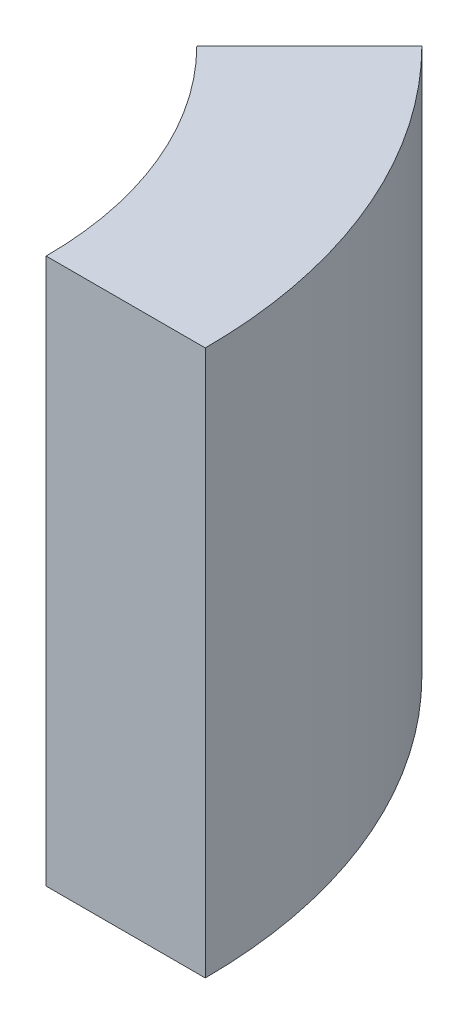
from build123d import *

# Parameters (mm, degrees)
BOSS_EXTRUDE1_DEPTH = 24
BOSS_EXTRUDE2_START = 1.5
BOSS_EXTRUDE2_DEPTH = 1.5


with BuildPart() as part:
    # Sketch1 → Boss-Extrude1 (new body)
    with BuildSketch(Plane(origin=(0, 0, 0), x_dir=(1, 0, 0), z_dir=(0, 1, 0))):
        with BuildLine():
            Line((11.313708499, 11.313708499), (16.263455967, 16.263455967))
            ThreePointArc((16.263455967, 16.263455967), (21.249229248, 8.801718944), (23, 0))
            Line((23, 0), (16, 0))
            ThreePointArc((16, 0), (14.78207252, 6.122934918), (11.313708499, 11.313708499))
        make_face()
    extrude(amount=BOSS_EXTRUDE1_DEPTH)

    # Sketch4 → Boss-Extrude2 (add)
    with BuildSketch(Plane.XZ.offset(BOSS_EXTRUDE2_START)):
        with BuildLine():
            Line((14.44136455, -6.888177549), (18.954290971, -9.040733033))
            ThreePointArc((18.954290971, -9.040733033), (19.401470183, -8.03635208), (19.795471313, -7.009944044))
            Line((19.795471313, -7.009944044), (15.082263857, -5.340909748))
            ThreePointArc((15.082263857, -5.340909748), (14.78207252, -6.122934918), (14.44136455, -6.888177549))
        make_face()
    extrude(amount=-BOSS_EXTRUDE2_DEPTH)


solid = part.part
